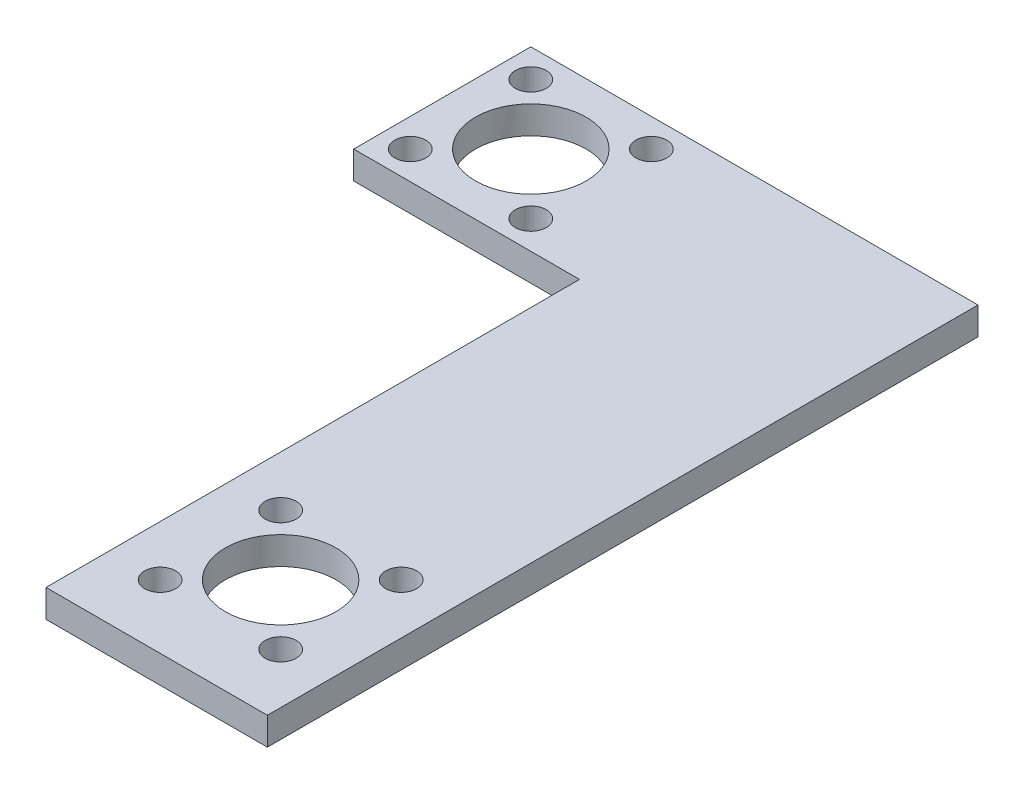
from build123d import *

# Parameters (mm, degrees)
BOSS_EXTRUDE1_DEPTH = 3.175
SKETCH7_R           = 6.35
SKETCH7_R_2         = 1.778
CUT_EXTRUDE3_DEPTH  = 3.175
CUT_EXTRUDE4_REACH  = 98.387
SKETCH8_R           = 6.35
SKETCH8_R_2         = 1.778


with BuildPart() as part:
    # Sketch1 → Boss-Extrude1 (new body)
    with BuildSketch(Plane(origin=(0, 0, 0), x_dir=(1, 0, 0), z_dir=(0, 1, 0))):
        Polygon((0, 0), (-51.308, 0), (-51.308, -20.32), (-25.4, -20.32), (-25.4, -81.534), (0, -81.534), align=None)
    extrude(amount=BOSS_EXTRUDE1_DEPTH)

    # Sketch7 → Cut-Extrude3 (cut)
    with BuildSketch(Plane(origin=(0, 3.175, 0), x_dir=(1, 0, 0), z_dir=(0, 1, 0))):
        with Locations(Location((-12.7, -67.31, 0), (0, 0, 270))):
            Circle(SKETCH7_R)
        with Locations(Location((-5.785202787, -60.395202787, 0), (0, 0, 270))):
            Circle(SKETCH7_R_2)
        with Locations(Location((-5.785202787, -74.224797213, 0), (0, 0, 270))):
            Circle(SKETCH7_R_2)
        with Locations(Location((-19.614797213, -74.224797213, 0), (0, 0, 270))):
            Circle(SKETCH7_R_2)
        with Locations(Location((-19.614797213, -60.395202787, 0), (0, 0, 270))):
            Circle(SKETCH7_R_2)
    extrude(amount=-CUT_EXTRUDE3_DEPTH, mode=Mode.SUBTRACT)

    # Sketch8 → Cut-Extrude4 (cut, up to next)
    with BuildSketch(Plane(origin=(0, 3.175, 0), x_dir=(1, 0, 0), z_dir=(0, 1, 0)), mode=Mode.PRIVATE) as cut_extrude4_sk1:
        with Locations(Location((-41.148, -10.16, 0), (0, 0, 270))):
            Circle(SKETCH8_R)
    cut_extrude4_tool1 = extrude(cut_extrude4_sk1.sketch, amount=-CUT_EXTRUDE4_REACH, mode=Mode.PRIVATE) & part.part
    # Sketch8 → Cut-Extrude4 (cut, up to next)
    with BuildSketch(Plane(origin=(0, 3.175, 0), x_dir=(1, 0, 0), z_dir=(0, 1, 0)), mode=Mode.PRIVATE) as cut_extrude4_sk2:
        with Locations(Location((-48.062797213, -3.245202787, 0), (0, 0, 270))):
            Circle(SKETCH8_R_2)
    cut_extrude4_tool2 = extrude(cut_extrude4_sk2.sketch, amount=-CUT_EXTRUDE4_REACH, mode=Mode.PRIVATE) & part.part
    # Sketch8 → Cut-Extrude4 (cut, up to next)
    with BuildSketch(Plane(origin=(0, 3.175, 0), x_dir=(1, 0, 0), z_dir=(0, 1, 0)), mode=Mode.PRIVATE) as cut_extrude4_sk3:
        with Locations(Location((-34.233202787, -3.245202787, 0), (0, 0, 270))):
            Circle(SKETCH8_R_2)
    cut_extrude4_tool3 = extrude(cut_extrude4_sk3.sketch, amount=-CUT_EXTRUDE4_REACH, mode=Mode.PRIVATE) & part.part
    # Sketch8 → Cut-Extrude4 (cut, up to next)
    with BuildSketch(Plane(origin=(0, 3.175, 0), x_dir=(1, 0, 0), z_dir=(0, 1, 0)), mode=Mode.PRIVATE) as cut_extrude4_sk4:
        with Locations(Location((-34.233202787, -17.074797213, 0), (0, 0, 270))):
            Circle(SKETCH8_R_2)
    cut_extrude4_tool4 = extrude(cut_extrude4_sk4.sketch, amount=-CUT_EXTRUDE4_REACH, mode=Mode.PRIVATE) & part.part
    # Sketch8 → Cut-Extrude4 (cut, up to next)
    with BuildSketch(Plane(origin=(0, 3.175, 0), x_dir=(1, 0, 0), z_dir=(0, 1, 0)), mode=Mode.PRIVATE) as cut_extrude4_sk5:
        with Locations(Location((-48.062797213, -17.074797213, 0), (0, 0, 270))):
            Circle(SKETCH8_R_2)
    cut_extrude4_tool5 = extrude(cut_extrude4_sk5.sketch, amount=-CUT_EXTRUDE4_REACH, mode=Mode.PRIVATE) & part.part
    add(cut_extrude4_tool1.solids().sort_by_distance((-41.148, 3.175, 10.16))[0], mode=Mode.SUBTRACT)
    add(cut_extrude4_tool2.solids().sort_by_distance((-48.062797, 3.175, 3.245203))[0], mode=Mode.SUBTRACT)
    add(cut_extrude4_tool3.solids().sort_by_distance((-34.233203, 3.175, 3.245203))[0], mode=Mode.SUBTRACT)
    add(cut_extrude4_tool4.solids().sort_by_distance((-34.233203, 3.175, 17.074797))[0], mode=Mode.SUBTRACT)
    add(cut_extrude4_tool5.solids().sort_by_distance((-48.062797, 3.175, 17.074797))[0], mode=Mode.SUBTRACT)


solid = part.part
